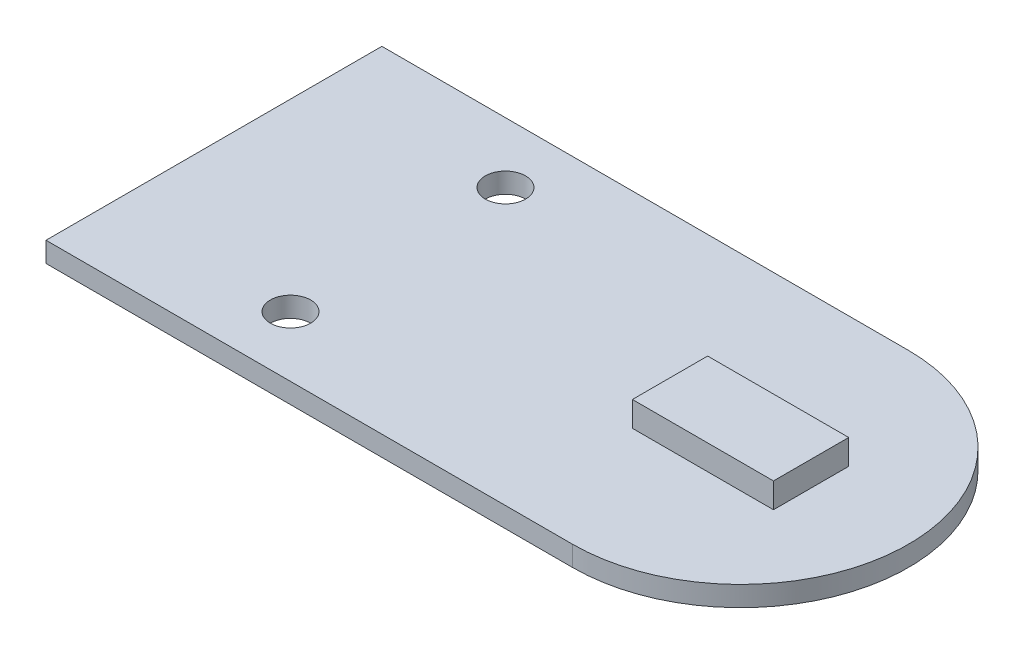
from build123d import *

# Parameters (mm, degrees)
SZKIC1_R                    = 1.5
DODANIE_WYCI_GNI_CIE1_DEPTH = 1.5
SZKIC2_W                    = 10.5
SZKIC2_H                    = 5.6
DODANIE_WYCI_GNI_CIE2_DEPTH = 1.86


with BuildPart() as part:
    # Szkic1 → Dodanie-wyciągnięcie1 (new body)
    with BuildSketch(Plane(origin=(0, 0, 0), x_dir=(1, 0, 0), z_dir=(0, 1, 0))):
        with BuildLine():
            Line((-39.2, 12.5), (0, 12.5))
            ThreePointArc((0, 12.5), (12.5, 0), (0, -12.5))
            Line((0, -12.5), (-39.2, -12.5))
            Line((-39.2, -12.5), (-39.2, 12.5))
        make_face()
        with Locations(Location((-25.5, 8, 0), (0, 0, 270))):
            Circle(SZKIC1_R, mode=Mode.SUBTRACT)
        with Locations(Location((-25.5, -8, 0), (0, 0, 90))):
            Circle(SZKIC1_R, mode=Mode.SUBTRACT)
    extrude(amount=DODANIE_WYCI_GNI_CIE1_DEPTH)

    # Szkic2 → Dodanie-wyciągnięcie2 (add)
    with BuildSketch(Plane(origin=(0, 1.5, 0), x_dir=(1, 0, 0), z_dir=(0, 1, 0))):
        Rectangle(SZKIC2_W, SZKIC2_H)
    extrude(amount=DODANIE_WYCI_GNI_CIE2_DEPTH)


solid = part.part
